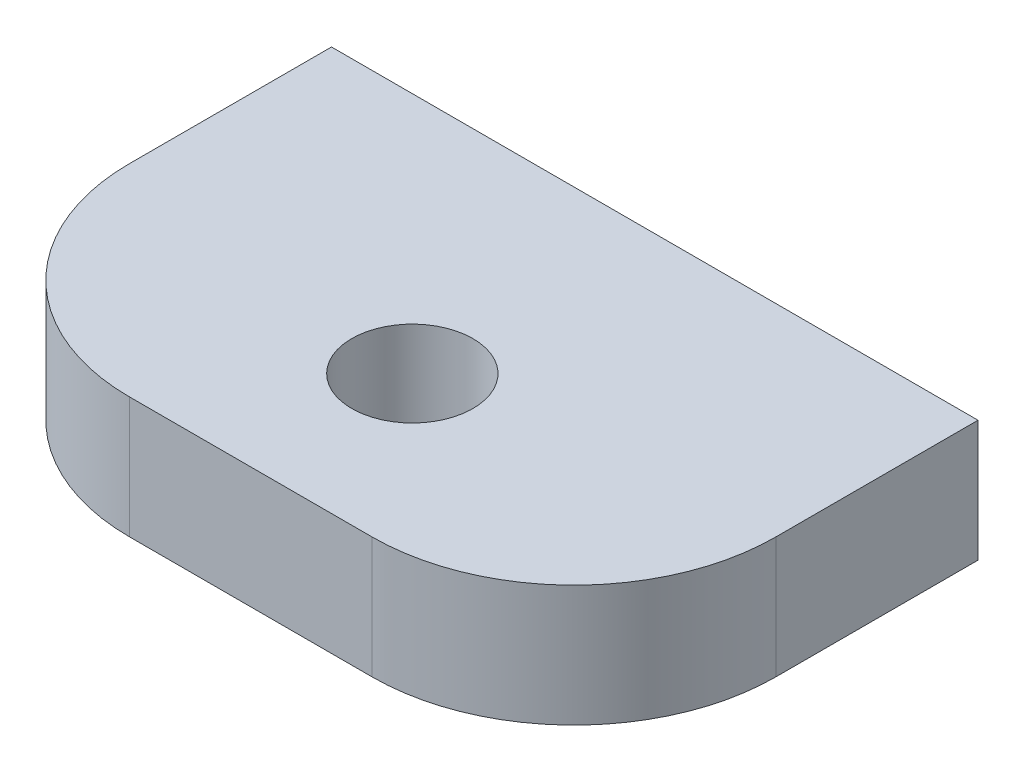
from build123d import *

# Parameters (mm, degrees)
SKETCH1_W           = 16
SKETCH1_H           = 10
BOSS_EXTRUDE1_DEPTH = 3
CUT_EXTRUDE1_REACH  = 11.899
SKETCH2_R           = 1.5
FILLET1_R           = 5


with BuildPart() as part:
    # Sketch1 → Boss-Extrude1 (new body)
    with BuildSketch(Plane(origin=(0, 0, 0), x_dir=(1, 0, 0), z_dir=(0, 1, 0))):
        Rectangle(SKETCH1_W, SKETCH1_H)
    extrude(amount=BOSS_EXTRUDE1_DEPTH)

    # Sketch2 → Cut-Extrude1 (cut, up to next)
    with BuildSketch(Plane(origin=(0, 0, 0), x_dir=(1, 0, 0), z_dir=(0, 1, 0)), mode=Mode.PRIVATE) as cut_extrude1_sk1:
        with Locations(Location((0, -1, 0), (0, 0, 90))):
            Circle(SKETCH2_R)
    cut_extrude1_tool1 = extrude(cut_extrude1_sk1.sketch, amount=CUT_EXTRUDE1_REACH, mode=Mode.PRIVATE) & part.part
    add(cut_extrude1_tool1.solids().sort_by_distance((0, 0, 1))[0], mode=Mode.SUBTRACT)

    # Fillet1
    fillet1_edges = [part.edges().sort_by_distance(p)[0] for p in [
        (8, 1.5, 5),
        (-8, 1.5, 5),
    ]]
    fillet(fillet1_edges, radius=FILLET1_R)


solid = part.part
